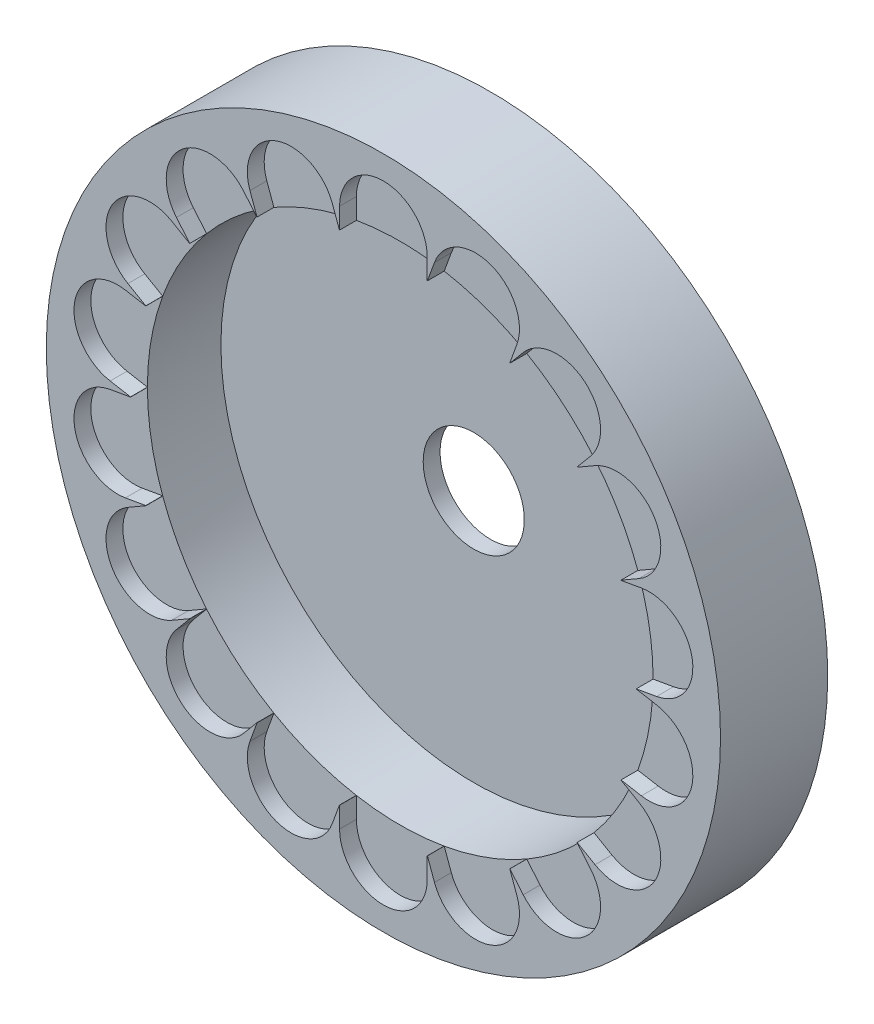
from build123d import *

# Parameters (mm, degrees)
SKETCH1_R           = 63.5
SKETCH1_R_2         = 47.625
BOSS_EXTRUDE1_DEPTH = 17.018
CUT_EXTRUDE1_DEPTH  = 3.175
CIRPATTERN1_COUNT   = 10
CIRPATTERN1_ANGLE   = 180
BOSS_EXTRUDE2_START = 3.175
SKETCH3_R           = 63.5
SKETCH3_R_2         = 9.525
BOSS_EXTRUDE2_DEPTH = 3.175


with BuildPart() as part:
    # Sketch1 → Boss-Extrude1 (new body)
    with BuildSketch(Plane.XY):
        Circle(SKETCH1_R)
        Circle(SKETCH1_R_2, mode=Mode.SUBTRACT)
    extrude(amount=BOSS_EXTRUDE1_DEPTH)

    # Sketch2 → Cut-Extrude1 (cut)
    with BuildSketch(Plane.XY.offset(17.018)):
        with BuildLine():
            Line((8.255, 50.8), (8.255, -50.8))
            ThreePointArc((8.255, -50.8), (0, -59.055), (-8.255, -50.8))
            Line((-8.255, -50.8), (-8.255, 50.8))
            ThreePointArc((-8.255, 50.8), (0, 59.055), (8.255, 50.8))
        make_face()
    cut_extrude1 = extrude(amount=-CUT_EXTRUDE1_DEPTH, mode=Mode.SUBTRACT)

    # CirPattern1: Cut-Extrude1 ×10 about axis
    cirpattern1_axis = Axis((0, 0, 0), (0, 0, 1))
    for i in range(1, CIRPATTERN1_COUNT):
        add(cut_extrude1.rotate(cirpattern1_axis, i * CIRPATTERN1_ANGLE / (CIRPATTERN1_COUNT - 1)), mode=Mode.SUBTRACT)

    # Sketch3 → Boss-Extrude2 (add)
    with BuildSketch(Plane(origin=(0, 0, 0), x_dir=(-1, 0, 0), z_dir=(0, 0, -1)).offset(BOSS_EXTRUDE2_START)):
        Circle(SKETCH3_R)
        Circle(SKETCH3_R_2, mode=Mode.SUBTRACT)
    extrude(amount=-BOSS_EXTRUDE2_DEPTH)


solid = part.part
